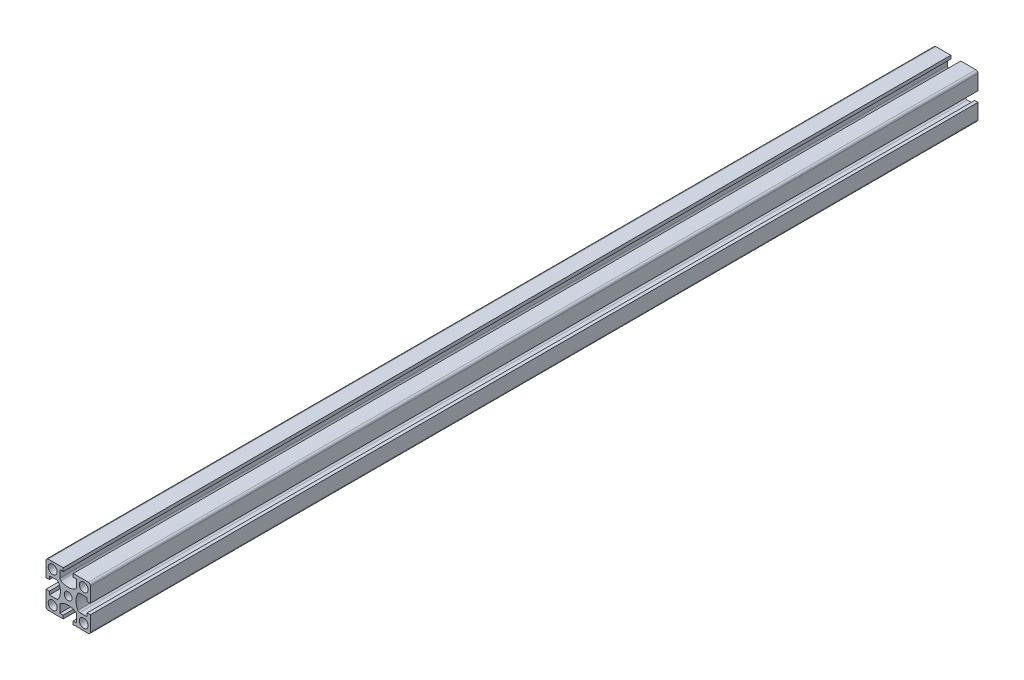
from build123d import *

# Parameters (mm, degrees)
SKETCH1_R           = 2.5
SKETCH1_R_2         = 2.1875
BOSS_EXTRUDE1_DEPTH = 500


with BuildPart() as part:
    # Sketch1 → Boss-Extrude1 (new body)
    with BuildSketch(Plane.XY):
        with BuildLine():
            Line((-12.5, 11.25), (-12.5, 2.8125))
            Line((-12.5, 2.8125), (-10.625, 2.8125))
            Line((-10.625, 2.8125), (-10.625, 4.6875))
            Line((-10.625, 4.6875), (-6.546075349, 4.6875))
            ThreePointArc((-6.546075349, 4.6875), (-5.921075349, 4.520031755), (-5.463543594, 4.0625))
            ThreePointArc((-5.463543594, 4.0625), (-4.375, 0), (-5.463543594, -4.0625))
            ThreePointArc((-5.463543594, -4.0625), (-5.921075349, -4.520031755), (-6.546075349, -4.6875))
            Line((-6.546075349, -4.6875), (-10.625, -4.6875))
            Line((-10.625, -4.6875), (-10.625, -2.8125))
            Line((-10.625, -2.8125), (-12.5, -2.8125))
            Line((-12.5, -2.8125), (-12.5, -11.25))
            ThreePointArc((-12.5, -11.25), (-12.133883476, -12.133883476), (-11.25, -12.5))
            Line((-11.25, -12.5), (-2.8125, -12.5))
            Line((-2.8125, -12.5), (-2.8125, -10.625))
            Line((-2.8125, -10.625), (-4.6875, -10.625))
            Line((-4.6875, -10.625), (-4.6875, -6.546075349))
            ThreePointArc((-4.6875, -6.546075349), (-4.520031755, -5.921075349), (-4.0625, -5.463543594))
            ThreePointArc((-4.0625, -5.463543594), (0, -4.375), (4.0625, -5.463543594))
            ThreePointArc((4.0625, -5.463543594), (4.520031755, -5.921075349), (4.6875, -6.546075349))
            Line((4.6875, -6.546075349), (4.6875, -10.625))
            Line((4.6875, -10.625), (2.8125, -10.625))
            Line((2.8125, -10.625), (2.8125, -12.5))
            Line((2.8125, -12.5), (11.25, -12.5))
            ThreePointArc((11.25, -12.5), (12.133883476, -12.133883476), (12.5, -11.25))
            Line((12.5, -11.25), (12.5, -2.8125))
            Line((12.5, -2.8125), (10.625, -2.8125))
            Line((10.625, -2.8125), (10.625, -4.6875))
            Line((10.625, -4.6875), (6.546075349, -4.6875))
            ThreePointArc((6.546075349, -4.6875), (5.921075349, -4.520031755), (5.463543594, -4.0625))
            ThreePointArc((5.463543594, -4.0625), (4.375, 0), (5.463543594, 4.0625))
            ThreePointArc((5.463543594, 4.0625), (5.921075349, 4.520031755), (6.546075349, 4.6875))
            Line((6.546075349, 4.6875), (10.625, 4.6875))
            Line((10.625, 4.6875), (10.625, 2.8125))
            Line((10.625, 2.8125), (12.5, 2.8125))
            Line((12.5, 2.8125), (12.5, 11.25))
            ThreePointArc((12.5, 11.25), (12.133883476, 12.133883476), (11.25, 12.5))
            Line((11.25, 12.5), (2.8125, 12.5))
            Line((2.8125, 12.5), (2.8125, 10.625))
            Line((2.8125, 10.625), (4.6875, 10.625))
            Line((4.6875, 10.625), (4.6875, 6.546075349))
            ThreePointArc((4.6875, 6.546075349), (4.520031755, 5.921075349), (4.0625, 5.463543594))
            ThreePointArc((4.0625, 5.463543594), (0, 4.375), (-4.0625, 5.463543594))
            ThreePointArc((-4.0625, 5.463543594), (-4.520031755, 5.921075349), (-4.6875, 6.546075349))
            Line((-4.6875, 6.546075349), (-4.6875, 10.625))
            Line((-4.6875, 10.625), (-2.8125, 10.625))
            Line((-2.8125, 10.625), (-2.8125, 12.5))
            Line((-2.8125, 12.5), (-11.25, 12.5))
            ThreePointArc((-11.25, 12.5), (-12.133883476, 12.133883476), (-12.5, 11.25))
        make_face()
        with Locations((-8.75, -8.75)):
            Circle(SKETCH1_R, mode=Mode.SUBTRACT)
        with Locations((8.75, -8.75)):
            Circle(SKETCH1_R, mode=Mode.SUBTRACT)
        with Locations((8.75, 8.75)):
            Circle(SKETCH1_R, mode=Mode.SUBTRACT)
        Circle(SKETCH1_R_2, mode=Mode.SUBTRACT)
        with Locations((-8.75, 8.75)):
            Circle(SKETCH1_R, mode=Mode.SUBTRACT)
    extrude(amount=BOSS_EXTRUDE1_DEPTH)


solid = part.part
